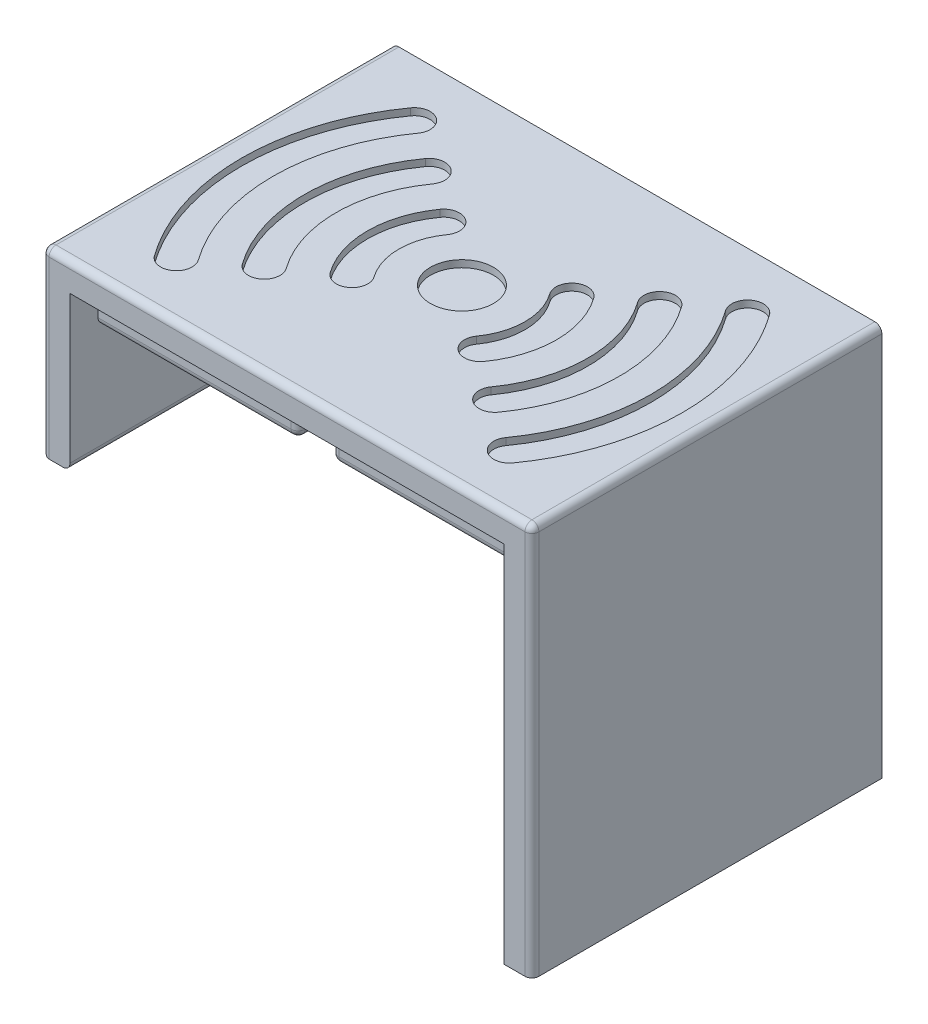
from build123d import *

# Parameters (mm, degrees)
SKETCH1_W           = 35
SKETCH1_H           = 25
BOSS_EXTRUDE1_DEPTH = 2
SKETCH3_W           = 2
SKETCH3_H           = 25
BOSS_EXTRUDE3_DEPTH = 11
SKETCH4_W           = 2
SKETCH4_H           = 25
BOSS_EXTRUDE4_DEPTH = 26
SKETCH5_W           = 14.3
SKETCH5_H           = 2
BOSS_EXTRUDE5_DEPTH = 3
SKETCH6_R           = 2.25
CUT_EXTRUDE1_DEPTH  = 0.5
FILLET1_R           = 0.5


with BuildPart() as part:
    # Sketch1 → Boss-Extrude1 (new body)
    with BuildSketch(Plane(origin=(0, 0, 0), x_dir=(1, 0, 0), z_dir=(0, 1, 0))):
        Rectangle(SKETCH1_W, SKETCH1_H)
    extrude(amount=BOSS_EXTRUDE1_DEPTH)

    # Sketch3 → Boss-Extrude3 (add)
    with BuildSketch(Plane(origin=(0, 0, 0), x_dir=(-1, 0, 0), z_dir=(0, -1, 0))):
        with Locations((16.5, 0)):
            Rectangle(SKETCH3_W, SKETCH3_H)
    extrude(amount=BOSS_EXTRUDE3_DEPTH)

    # Sketch4 → Boss-Extrude4 (add)
    with BuildSketch(Plane.XZ):
        with Locations((16.5, 0)):
            Rectangle(SKETCH4_W, SKETCH4_H)
    extrude(amount=BOSS_EXTRUDE4_DEPTH)

    # Sketch5 → Boss-Extrude5 (add)
    with BuildSketch(Plane.XZ):
        with Locations((8.35, 9.5)):
            Rectangle(SKETCH5_W, SKETCH5_H)
        with Locations((-8.35, 9.5)):
            Rectangle(SKETCH5_W, SKETCH5_H)
        with Locations((-8.35, -9.5)):
            Rectangle(SKETCH5_W, SKETCH5_H)
        with Locations((8.35, -9.5)):
            Rectangle(SKETCH5_W, SKETCH5_H)
    extrude(amount=BOSS_EXTRUDE5_DEPTH)

    # Sketch6 → Cut-Extrude1 (cut)
    with BuildSketch(Plane(origin=(0, 2, 0), x_dir=(1, 0, 0), z_dir=(0, 1, 0))):
        with Locations(Location((0, 0, 0), (0, 0, 270))):
            Circle(SKETCH6_R)
        with BuildLine():
            ThreePointArc((9.154501609, -6.538929598), (11.25, 1e-08), (9.154501598, 6.538929614))
            ThreePointArc((9.154501598, 6.538929614), (7.585158455, 6.800486886), (7.323601248, 5.231143733))
            ThreePointArc((7.323601248, 5.231143733), (9, -9e-09), (7.323601238, -5.231143747))
            ThreePointArc((7.323601238, -5.231143747), (7.58515847, -6.800486897), (9.154501609, -6.538929598))
        make_face()
        with BuildLine():
            ThreePointArc((-7.323601248, -5.231143733), (-9, -5e-09), (-7.323601254, 5.231143725))
            ThreePointArc((-7.323601254, 5.231143725), (-7.585158451, 6.800486883), (-9.154501598, 6.538929614))
            ThreePointArc((-9.154501598, 6.538929614), (-11.25, -1.2e-08), (-9.154501584, -6.538929633))
            ThreePointArc((-9.154501584, -6.538929633), (-7.585158446, -6.800486879), (-7.323601248, -5.231143733))
        make_face()
        with BuildLine():
            ThreePointArc((5.492700959, -3.923357768), (6.75, -1e-08), (5.492700971, 3.923357752))
            ThreePointArc((5.492700971, 3.923357752), (3.923357826, 4.184915008), (3.661800635, 2.615571852))
            ThreePointArc((3.661800635, 2.615571852), (4.5, -2.4e-08), (3.661800607, -2.61557189))
            ThreePointArc((3.661800607, -2.61557189), (3.923357837, -4.184915016), (5.492700959, -3.923357768))
        make_face()
        with BuildLine():
            ThreePointArc((-3.661800619, -2.615571874), (-4.5, 1.3e-08), (-3.661800604, 2.615571895))
            ThreePointArc((-3.661800604, 2.615571895), (-3.923357847, 4.184915023), (-5.492700971, 3.923357752))
            ThreePointArc((-5.492700971, 3.923357752), (-6.75, 0), (-5.492700971, -3.923357752))
            ThreePointArc((-5.492700971, -3.923357752), (-3.923357837, -4.184915016), (-3.661800619, -2.615571874))
        make_face()
        with BuildLine():
            ThreePointArc((10.985401866, 7.846715609), (13.5, 1.4e-08), (10.985401882, -7.846715586))
            ThreePointArc((10.985401882, -7.846715586), (11.246959012, -9.416058712), (12.81630214, -9.154501596))
            ThreePointArc((12.81630214, -9.154501596), (15.75, 2.5e-08), (12.816302111, 9.154501636))
            ThreePointArc((12.816302111, 9.154501636), (11.246959003, 9.416058706), (10.985401866, 7.846715609))
        make_face()
        with BuildLine():
            ThreePointArc((-10.985401876, -7.846715595), (-13.5, 4e-08), (-10.985401829, 7.84671566))
            ThreePointArc((-10.985401829, 7.84671566), (-11.246959061, 9.416058747), (-12.816302157, 9.154501571))
            ThreePointArc((-12.816302157, 9.154501571), (-15.75, 4.9e-08), (-12.816302215, -9.154501491))
            ThreePointArc((-12.816302215, -9.154501491), (-11.246959069, -9.416058753), (-10.985401876, -7.846715595))
        make_face()
    extrude(amount=-CUT_EXTRUDE1_DEPTH, mode=Mode.SUBTRACT)

    # Fillet1
    fillet1_edges = [part.edges().sort_by_distance(p)[0] for p in [
        (-17.5, 2, 0),
        (-17.5, -4.5, 12.5),
        (-17.5, -11, 0),
        (17.5, 2, 0),
        (17.5, -12, 12.5),
        (15.5, 0, 0),
        (-15.5, 0, 0),
        (8.35, -3, -8.5),
        (-8.35, -3, -8.5),
        (-8.35, -3, 8.5),
        (-8.35, -3, 10.5),
        (8.35, -3, 10.5),
        (-1.2, -1.5, 10.5),
        (-1.2, -1.5, 8.5),
        (1.2, -3, 9.5),
        (1.2, -1.5, 10.5),
        (1.2, -1.5, 8.5),
        (-1.2, -1.5, -10.5),
        (-1.2, -1.5, -8.5),
        (1.2, -1.5, -8.5),
        (1.2, -1.5, -10.5),
        (8.35, -3, -10.5),
        (-8.35, -3, -10.5),
        (0, 2, 12.5),
        (-15.5, -11, 0),
        (-1.2, -3, 9.5),
        (-1.2, -3, -9.5),
        (1.2, -3, -9.5),
        (15.5, -13, -12.5),
        (-15.5, -5.5, -12.5),
    ]]
    fillet(fillet1_edges, radius=FILLET1_R)


solid = part.part
